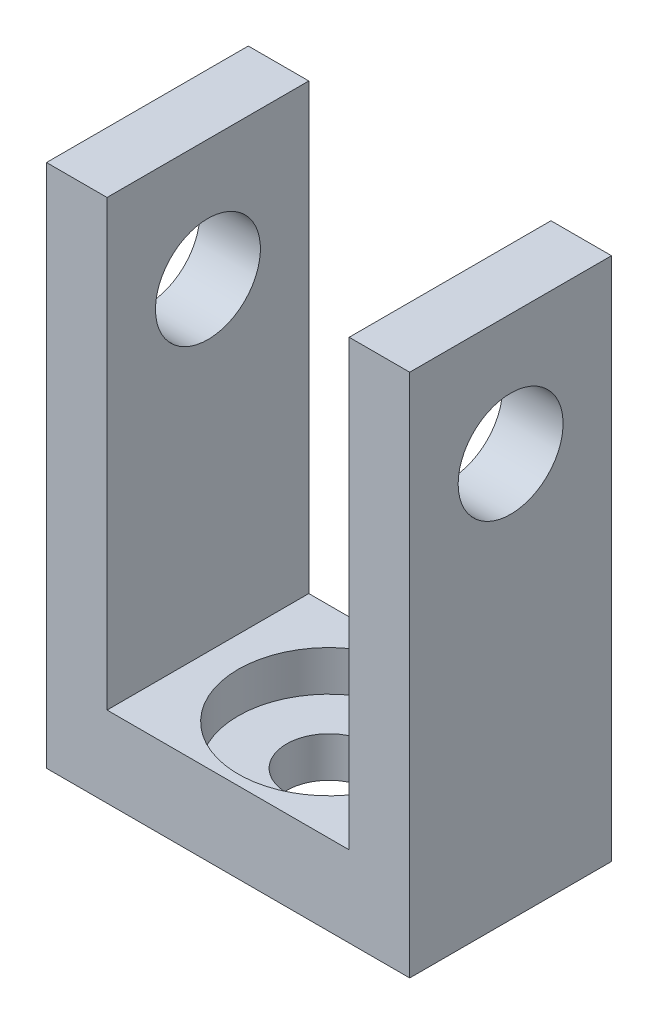
from build123d import *

# Parameters (mm, degrees)
BOSS_EXTRUDE1_DEPTH = 10
SKETCH2_R           = 2.6
CUT_EXTRUDE4_DEPTH  = 25
CUT_EXTRUDE5_DEPTH  = 10
SKETCH6_R           = 4.5
CUT_EXTRUDE6_DEPTH  = 2
BOSS_EXTRUDE2_START = 1
SKETCH7_W           = 18
SKETCH7_H           = 10
SKETCH7_R           = 2.1
BOSS_EXTRUDE2_DEPTH = 1


with BuildPart() as part:
    # Sketch1 → Boss-Extrude1 (new body)
    with BuildSketch(Plane.XY):
        Polygon((-6, 0), (6, 0), (6, 22), (9, 22), (9, -3), (-9, -3), (-9, 22), (-6, 22), align=None)
    extrude(amount=BOSS_EXTRUDE1_DEPTH)

    # Sketch2 → Cut-Extrude4 (cut)
    with BuildSketch(Plane.ZY.offset(9)):
        with Locations((5, 16)):
            Circle(SKETCH2_R)
    extrude(amount=-CUT_EXTRUDE4_DEPTH, mode=Mode.SUBTRACT)

    # Sketch5 → Cut-Extrude5 (cut)
    with BuildSketch(Plane.XZ.offset(3)):
        with BuildLine():
            Line((2.1, 5), (0, 5))
            Line((0, 5), (-2.1, 5))
            ThreePointArc((-2.1, 5), (0, 2.9), (2.1, 5))
        make_face()
        with BuildLine():
            Line((0, 7.1), (0, 5))
            Line((0, 5), (2.1, 5))
            ThreePointArc((2.1, 5), (1.48492424, 6.48492424), (0, 7.1))
        make_face()
        with BuildLine():
            Line((-2.1, 5), (0, 5))
            Line((0, 5), (0, 7.1))
            ThreePointArc((0, 7.1), (-1.48492424, 6.48492424), (-2.1, 5))
        make_face()
    extrude(amount=-CUT_EXTRUDE5_DEPTH, mode=Mode.SUBTRACT)

    # Sketch6 → Cut-Extrude6 (cut)
    with BuildSketch(Plane(origin=(0, 0, 0), x_dir=(1, 0, 0), z_dir=(0, 1, 0))):
        with Locations(Location((0, -5, 0), (0, 0, 180))):
            Circle(SKETCH6_R)
    extrude(amount=-CUT_EXTRUDE6_DEPTH, mode=Mode.SUBTRACT)

    # Sketch7 → Boss-Extrude2 (add)
    with BuildSketch(Plane.XZ.offset(3).offset(BOSS_EXTRUDE2_START)):
        with Locations((0, 5)):
            Rectangle(SKETCH7_W, SKETCH7_H)
        with Locations(Location((0, 5, 0), (0, 0, 270))):
            Circle(SKETCH7_R, mode=Mode.SUBTRACT)
    extrude(amount=-BOSS_EXTRUDE2_DEPTH)


solid = part.part
